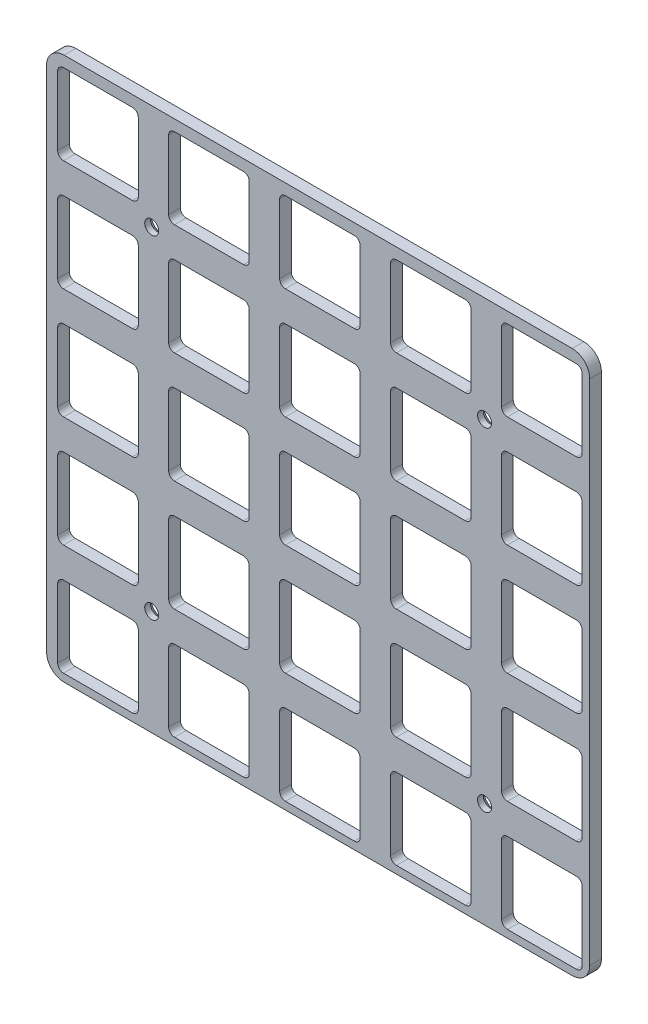
from build123d import *

# Parameters (mm, degrees)
BOSS_EXTRUDE1_DEPTH                            = 2
CSK_FOR_M2_FLAT_HEAD_MACHINE_SCREW5_AT_2_COUNT = 2
CSK_FOR_M2_FLAT_HEAD_MACHINE_SCREW5_AT_2_PITCH = 57
CSK_FOR_M2_FLAT_HEAD_MACHINE_SCREW5_AT_3_COUNT = 2
CSK_FOR_M2_FLAT_HEAD_MACHINE_SCREW5_AT_3_PITCH = 80.610173055
CSK_FOR_M2_FLAT_HEAD_MACHINE_SCREW5_AT_4_COUNT = 2
CSK_FOR_M2_FLAT_HEAD_MACHINE_SCREW5_AT_4_PITCH = 57


with BuildPart() as part:
    # Sketch2 → Boss-Extrude1 (new body)
    with BuildSketch(Plane.XY):
        with BuildLine():
            Line((-43.5, 46.5), (43.5, 46.5))
            ThreePointArc((43.5, 46.5), (45.621320344, 45.621320344), (46.5, 43.5))
            Line((46.5, 43.5), (46.5, -43.5))
            ThreePointArc((46.5, -43.5), (45.621320344, -45.621320344), (43.5, -46.5))
            Line((43.5, -46.5), (-43.5, -46.5))
            ThreePointArc((-43.5, -46.5), (-45.621320344, -45.621320344), (-46.5, -43.5))
            Line((-46.5, -43.5), (-46.5, 43.5))
            ThreePointArc((-46.5, 43.5), (-45.621320344, 45.621320344), (-43.5, 46.5))
        make_face()
        with BuildLine():
            Line((-25.6, 43.6), (-25.6, 31.8))
            ThreePointArc((-25.6, 31.8), (-25.307106781, 31.092893219), (-24.6, 30.8))
            Line((-24.6, 30.8), (-12.8, 30.8))
            ThreePointArc((-12.8, 30.8), (-12.092893219, 31.092893219), (-11.8, 31.8))
            Line((-11.8, 31.8), (-11.8, 43.6))
            ThreePointArc((-11.8, 43.6), (-12.092893219, 44.307106781), (-12.8, 44.6))
            Line((-12.8, 44.6), (-24.6, 44.6))
            ThreePointArc((-24.6, 44.6), (-25.307106781, 44.307106781), (-25.6, 43.6))
        make_face(mode=Mode.SUBTRACT)
        with BuildLine():
            Line((-43.6, 44.6), (-31.8, 44.6))
            ThreePointArc((-31.8, 44.6), (-31.092893219, 44.307106781), (-30.8, 43.6))
            Line((-30.8, 43.6), (-30.8, 31.8))
            ThreePointArc((-30.8, 31.8), (-31.092893219, 31.092893219), (-31.8, 30.8))
            Line((-31.8, 30.8), (-43.6, 30.8))
            ThreePointArc((-43.6, 30.8), (-44.307106781, 31.092893219), (-44.6, 31.8))
            Line((-44.6, 31.8), (-44.6, 43.6))
            ThreePointArc((-44.6, 43.6), (-44.307106781, 44.307106781), (-43.6, 44.6))
        make_face(mode=Mode.SUBTRACT)
        with BuildLine():
            Line((-6.6, 43.6), (-6.6, 31.8))
            ThreePointArc((-6.6, 31.8), (-6.307106781, 31.092893219), (-5.6, 30.8))
            Line((-5.6, 30.8), (6.2, 30.8))
            ThreePointArc((6.2, 30.8), (6.907106781, 31.092893219), (7.2, 31.8))
            Line((7.2, 31.8), (7.2, 43.6))
            ThreePointArc((7.2, 43.6), (6.907106781, 44.307106781), (6.2, 44.6))
            Line((6.2, 44.6), (-5.6, 44.6))
            ThreePointArc((-5.6, 44.6), (-6.307106781, 44.307106781), (-6.6, 43.6))
        make_face(mode=Mode.SUBTRACT)
        with BuildLine():
            Line((12.4, 43.6), (12.4, 31.8))
            ThreePointArc((12.4, 31.8), (12.692893219, 31.092893219), (13.4, 30.8))
            Line((13.4, 30.8), (25.2, 30.8))
            ThreePointArc((25.2, 30.8), (25.907106781, 31.092893219), (26.2, 31.8))
            Line((26.2, 31.8), (26.2, 43.6))
            ThreePointArc((26.2, 43.6), (25.907106781, 44.307106781), (25.2, 44.6))
            Line((25.2, 44.6), (13.4, 44.6))
            ThreePointArc((13.4, 44.6), (12.692893219, 44.307106781), (12.4, 43.6))
        make_face(mode=Mode.SUBTRACT)
        with BuildLine():
            Line((31.4, 43.6), (31.4, 31.8))
            ThreePointArc((31.4, 31.8), (31.692893219, 31.092893219), (32.4, 30.8))
            Line((32.4, 30.8), (44.2, 30.8))
            ThreePointArc((44.2, 30.8), (44.907106781, 31.092893219), (45.2, 31.8))
            Line((45.2, 31.8), (45.2, 43.6))
            ThreePointArc((45.2, 43.6), (44.907106781, 44.307106781), (44.2, 44.6))
            Line((44.2, 44.6), (32.4, 44.6))
            ThreePointArc((32.4, 44.6), (31.692893219, 44.307106781), (31.4, 43.6))
        make_face(mode=Mode.SUBTRACT)
        with BuildLine():
            Line((-25.6, 24.6), (-25.6, 12.8))
            ThreePointArc((-25.6, 12.8), (-25.307106781, 12.092893219), (-24.6, 11.8))
            Line((-24.6, 11.8), (-12.8, 11.8))
            ThreePointArc((-12.8, 11.8), (-12.092893219, 12.092893219), (-11.8, 12.8))
            Line((-11.8, 12.8), (-11.8, 24.6))
            ThreePointArc((-11.8, 24.6), (-12.092893219, 25.307106781), (-12.8, 25.6))
            Line((-12.8, 25.6), (-24.6, 25.6))
            ThreePointArc((-24.6, 25.6), (-25.307106781, 25.307106781), (-25.6, 24.6))
        make_face(mode=Mode.SUBTRACT)
        with BuildLine():
            Line((-6.6, 24.6), (-6.6, 12.8))
            ThreePointArc((-6.6, 12.8), (-6.307106781, 12.092893219), (-5.6, 11.8))
            Line((-5.6, 11.8), (6.2, 11.8))
            ThreePointArc((6.2, 11.8), (6.907106781, 12.092893219), (7.2, 12.8))
            Line((7.2, 12.8), (7.2, 24.6))
            ThreePointArc((7.2, 24.6), (6.907106781, 25.307106781), (6.2, 25.6))
            Line((6.2, 25.6), (-5.6, 25.6))
            ThreePointArc((-5.6, 25.6), (-6.307106781, 25.307106781), (-6.6, 24.6))
        make_face(mode=Mode.SUBTRACT)
        with BuildLine():
            Line((12.4, 24.6), (12.4, 12.8))
            ThreePointArc((12.4, 12.8), (12.692893219, 12.092893219), (13.4, 11.8))
            Line((13.4, 11.8), (25.2, 11.8))
            ThreePointArc((25.2, 11.8), (25.907106781, 12.092893219), (26.2, 12.8))
            Line((26.2, 12.8), (26.2, 24.6))
            ThreePointArc((26.2, 24.6), (25.907106781, 25.307106781), (25.2, 25.6))
            Line((25.2, 25.6), (13.4, 25.6))
            ThreePointArc((13.4, 25.6), (12.692893219, 25.307106781), (12.4, 24.6))
        make_face(mode=Mode.SUBTRACT)
        with BuildLine():
            Line((31.4, 24.6), (31.4, 12.8))
            ThreePointArc((31.4, 12.8), (31.692893219, 12.092893219), (32.4, 11.8))
            Line((32.4, 11.8), (44.2, 11.8))
            ThreePointArc((44.2, 11.8), (44.907106781, 12.092893219), (45.2, 12.8))
            Line((45.2, 12.8), (45.2, 24.6))
            ThreePointArc((45.2, 24.6), (44.907106781, 25.307106781), (44.2, 25.6))
            Line((44.2, 25.6), (32.4, 25.6))
            ThreePointArc((32.4, 25.6), (31.692893219, 25.307106781), (31.4, 24.6))
        make_face(mode=Mode.SUBTRACT)
        with BuildLine():
            Line((-25.6, 5.6), (-25.6, -6.2))
            ThreePointArc((-25.6, -6.2), (-25.307106781, -6.907106781), (-24.6, -7.2))
            Line((-24.6, -7.2), (-12.8, -7.2))
            ThreePointArc((-12.8, -7.2), (-12.092893219, -6.907106781), (-11.8, -6.2))
            Line((-11.8, -6.2), (-11.8, 5.6))
            ThreePointArc((-11.8, 5.6), (-12.092893219, 6.307106781), (-12.8, 6.6))
            Line((-12.8, 6.6), (-24.6, 6.6))
            ThreePointArc((-24.6, 6.6), (-25.307106781, 6.307106781), (-25.6, 5.6))
        make_face(mode=Mode.SUBTRACT)
        with BuildLine():
            Line((-6.6, 5.6), (-6.6, -6.2))
            ThreePointArc((-6.6, -6.2), (-6.307106781, -6.907106781), (-5.6, -7.2))
            Line((-5.6, -7.2), (6.2, -7.2))
            ThreePointArc((6.2, -7.2), (6.907106781, -6.907106781), (7.2, -6.2))
            Line((7.2, -6.2), (7.2, 5.6))
            ThreePointArc((7.2, 5.6), (6.907106781, 6.307106781), (6.2, 6.6))
            Line((6.2, 6.6), (-5.6, 6.6))
            ThreePointArc((-5.6, 6.6), (-6.307106781, 6.307106781), (-6.6, 5.6))
        make_face(mode=Mode.SUBTRACT)
        with BuildLine():
            Line((12.4, 5.6), (12.4, -6.2))
            ThreePointArc((12.4, -6.2), (12.692893219, -6.907106781), (13.4, -7.2))
            Line((13.4, -7.2), (25.2, -7.2))
            ThreePointArc((25.2, -7.2), (25.907106781, -6.907106781), (26.2, -6.2))
            Line((26.2, -6.2), (26.2, 5.6))
            ThreePointArc((26.2, 5.6), (25.907106781, 6.307106781), (25.2, 6.6))
            Line((25.2, 6.6), (13.4, 6.6))
            ThreePointArc((13.4, 6.6), (12.692893219, 6.307106781), (12.4, 5.6))
        make_face(mode=Mode.SUBTRACT)
        with BuildLine():
            Line((31.4, 5.6), (31.4, -6.2))
            ThreePointArc((31.4, -6.2), (31.692893219, -6.907106781), (32.4, -7.2))
            Line((32.4, -7.2), (44.2, -7.2))
            ThreePointArc((44.2, -7.2), (44.907106781, -6.907106781), (45.2, -6.2))
            Line((45.2, -6.2), (45.2, 5.6))
            ThreePointArc((45.2, 5.6), (44.907106781, 6.307106781), (44.2, 6.6))
            Line((44.2, 6.6), (32.4, 6.6))
            ThreePointArc((32.4, 6.6), (31.692893219, 6.307106781), (31.4, 5.6))
        make_face(mode=Mode.SUBTRACT)
        with BuildLine():
            Line((-25.6, -13.4), (-25.6, -25.2))
            ThreePointArc((-25.6, -25.2), (-25.307106781, -25.907106781), (-24.6, -26.2))
            Line((-24.6, -26.2), (-12.8, -26.2))
            ThreePointArc((-12.8, -26.2), (-12.092893219, -25.907106781), (-11.8, -25.2))
            Line((-11.8, -25.2), (-11.8, -13.4))
            ThreePointArc((-11.8, -13.4), (-12.092893219, -12.692893219), (-12.8, -12.4))
            Line((-12.8, -12.4), (-24.6, -12.4))
            ThreePointArc((-24.6, -12.4), (-25.307106781, -12.692893219), (-25.6, -13.4))
        make_face(mode=Mode.SUBTRACT)
        with BuildLine():
            Line((-6.6, -13.4), (-6.6, -25.2))
            ThreePointArc((-6.6, -25.2), (-6.307106781, -25.907106781), (-5.6, -26.2))
            Line((-5.6, -26.2), (6.2, -26.2))
            ThreePointArc((6.2, -26.2), (6.907106781, -25.907106781), (7.2, -25.2))
            Line((7.2, -25.2), (7.2, -13.4))
            ThreePointArc((7.2, -13.4), (6.907106781, -12.692893219), (6.2, -12.4))
            Line((6.2, -12.4), (-5.6, -12.4))
            ThreePointArc((-5.6, -12.4), (-6.307106781, -12.692893219), (-6.6, -13.4))
        make_face(mode=Mode.SUBTRACT)
        with BuildLine():
            Line((12.4, -13.4), (12.4, -25.2))
            ThreePointArc((12.4, -25.2), (12.692893219, -25.907106781), (13.4, -26.2))
            Line((13.4, -26.2), (25.2, -26.2))
            ThreePointArc((25.2, -26.2), (25.907106781, -25.907106781), (26.2, -25.2))
            Line((26.2, -25.2), (26.2, -13.4))
            ThreePointArc((26.2, -13.4), (25.907106781, -12.692893219), (25.2, -12.4))
            Line((25.2, -12.4), (13.4, -12.4))
            ThreePointArc((13.4, -12.4), (12.692893219, -12.692893219), (12.4, -13.4))
        make_face(mode=Mode.SUBTRACT)
        with BuildLine():
            Line((31.4, -13.4), (31.4, -25.2))
            ThreePointArc((31.4, -25.2), (31.692893219, -25.907106781), (32.4, -26.2))
            Line((32.4, -26.2), (44.2, -26.2))
            ThreePointArc((44.2, -26.2), (44.907106781, -25.907106781), (45.2, -25.2))
            Line((45.2, -25.2), (45.2, -13.4))
            ThreePointArc((45.2, -13.4), (44.907106781, -12.692893219), (44.2, -12.4))
            Line((44.2, -12.4), (32.4, -12.4))
            ThreePointArc((32.4, -12.4), (31.692893219, -12.692893219), (31.4, -13.4))
        make_face(mode=Mode.SUBTRACT)
        with BuildLine():
            Line((-25.6, -32.4), (-25.6, -44.2))
            ThreePointArc((-25.6, -44.2), (-25.307106781, -44.907106781), (-24.6, -45.2))
            Line((-24.6, -45.2), (-12.8, -45.2))
            ThreePointArc((-12.8, -45.2), (-12.092893219, -44.907106781), (-11.8, -44.2))
            Line((-11.8, -44.2), (-11.8, -32.4))
            ThreePointArc((-11.8, -32.4), (-12.092893219, -31.692893219), (-12.8, -31.4))
            Line((-12.8, -31.4), (-24.6, -31.4))
            ThreePointArc((-24.6, -31.4), (-25.307106781, -31.692893219), (-25.6, -32.4))
        make_face(mode=Mode.SUBTRACT)
        with BuildLine():
            Line((-6.6, -32.4), (-6.6, -44.2))
            ThreePointArc((-6.6, -44.2), (-6.307106781, -44.907106781), (-5.6, -45.2))
            Line((-5.6, -45.2), (6.2, -45.2))
            ThreePointArc((6.2, -45.2), (6.907106781, -44.907106781), (7.2, -44.2))
            Line((7.2, -44.2), (7.2, -32.4))
            ThreePointArc((7.2, -32.4), (6.907106781, -31.692893219), (6.2, -31.4))
            Line((6.2, -31.4), (-5.6, -31.4))
            ThreePointArc((-5.6, -31.4), (-6.307106781, -31.692893219), (-6.6, -32.4))
        make_face(mode=Mode.SUBTRACT)
        with BuildLine():
            Line((12.4, -32.4), (12.4, -44.2))
            ThreePointArc((12.4, -44.2), (12.692893219, -44.907106781), (13.4, -45.2))
            Line((13.4, -45.2), (25.2, -45.2))
            ThreePointArc((25.2, -45.2), (25.907106781, -44.907106781), (26.2, -44.2))
            Line((26.2, -44.2), (26.2, -32.4))
            ThreePointArc((26.2, -32.4), (25.907106781, -31.692893219), (25.2, -31.4))
            Line((25.2, -31.4), (13.4, -31.4))
            ThreePointArc((13.4, -31.4), (12.692893219, -31.692893219), (12.4, -32.4))
        make_face(mode=Mode.SUBTRACT)
        with BuildLine():
            Line((31.4, -32.4), (31.4, -44.2))
            ThreePointArc((31.4, -44.2), (31.692893219, -44.907106781), (32.4, -45.2))
            Line((32.4, -45.2), (44.2, -45.2))
            ThreePointArc((44.2, -45.2), (44.907106781, -44.907106781), (45.2, -44.2))
            Line((45.2, -44.2), (45.2, -32.4))
            ThreePointArc((45.2, -32.4), (44.907106781, -31.692893219), (44.2, -31.4))
            Line((44.2, -31.4), (32.4, -31.4))
            ThreePointArc((32.4, -31.4), (31.692893219, -31.692893219), (31.4, -32.4))
        make_face(mode=Mode.SUBTRACT)
        with BuildLine():
            Line((-44.6, 24.6), (-44.6, 12.8))
            ThreePointArc((-44.6, 12.8), (-44.307106781, 12.092893219), (-43.6, 11.8))
            Line((-43.6, 11.8), (-31.8, 11.8))
            ThreePointArc((-31.8, 11.8), (-31.092893219, 12.092893219), (-30.8, 12.8))
            Line((-30.8, 12.8), (-30.8, 24.6))
            ThreePointArc((-30.8, 24.6), (-31.092893219, 25.307106781), (-31.8, 25.6))
            Line((-31.8, 25.6), (-43.6, 25.6))
            ThreePointArc((-43.6, 25.6), (-44.307106781, 25.307106781), (-44.6, 24.6))
        make_face(mode=Mode.SUBTRACT)
        with BuildLine():
            Line((-44.6, 5.6), (-44.6, -6.2))
            ThreePointArc((-44.6, -6.2), (-44.307106781, -6.907106781), (-43.6, -7.2))
            Line((-43.6, -7.2), (-31.8, -7.2))
            ThreePointArc((-31.8, -7.2), (-31.092893219, -6.907106781), (-30.8, -6.2))
            Line((-30.8, -6.2), (-30.8, 5.6))
            ThreePointArc((-30.8, 5.6), (-31.092893219, 6.307106781), (-31.8, 6.6))
            Line((-31.8, 6.6), (-43.6, 6.6))
            ThreePointArc((-43.6, 6.6), (-44.307106781, 6.307106781), (-44.6, 5.6))
        make_face(mode=Mode.SUBTRACT)
        with BuildLine():
            Line((-44.6, -13.4), (-44.6, -25.2))
            ThreePointArc((-44.6, -25.2), (-44.307106781, -25.907106781), (-43.6, -26.2))
            Line((-43.6, -26.2), (-31.8, -26.2))
            ThreePointArc((-31.8, -26.2), (-31.092893219, -25.907106781), (-30.8, -25.2))
            Line((-30.8, -25.2), (-30.8, -13.4))
            ThreePointArc((-30.8, -13.4), (-31.092893219, -12.692893219), (-31.8, -12.4))
            Line((-31.8, -12.4), (-43.6, -12.4))
            ThreePointArc((-43.6, -12.4), (-44.307106781, -12.692893219), (-44.6, -13.4))
        make_face(mode=Mode.SUBTRACT)
        with BuildLine():
            Line((-44.6, -32.4), (-44.6, -44.2))
            ThreePointArc((-44.6, -44.2), (-44.307106781, -44.907106781), (-43.6, -45.2))
            Line((-43.6, -45.2), (-31.8, -45.2))
            ThreePointArc((-31.8, -45.2), (-31.092893219, -44.907106781), (-30.8, -44.2))
            Line((-30.8, -44.2), (-30.8, -32.4))
            ThreePointArc((-30.8, -32.4), (-31.092893219, -31.692893219), (-31.8, -31.4))
            Line((-31.8, -31.4), (-43.6, -31.4))
            ThreePointArc((-43.6, -31.4), (-44.307106781, -31.692893219), (-44.6, -32.4))
        make_face(mode=Mode.SUBTRACT)
    extrude(amount=BOSS_EXTRUDE1_DEPTH)

    # Sketch7 → CSK for M2 Flat Head Machine Screw5 (revolve, cut)
    with BuildSketch(Plane(origin=(-28.5, -28.5, 0), x_dir=(0, 1, 0), z_dir=(1, 0, 0))):
        Polygon((0, 0), (0, 2), (1.2, 2), (1.2, 1), (2.2, 0), align=None)
    csk_for_m2_flat_head_machine_screw5 = revolve(axis=Axis((-28.5, -28.5, -6.35), (0, 0, 1)), mode=Mode.SUBTRACT)

    # CSK for M2 Flat Head Machine Screw5 at 2: CSK for M2 Flat Head Machine Screw5 ×2
    with Locations(*[(i * CSK_FOR_M2_FLAT_HEAD_MACHINE_SCREW5_AT_2_PITCH, 0, 0) for i in range(1, CSK_FOR_M2_FLAT_HEAD_MACHINE_SCREW5_AT_2_COUNT)]):
        add(csk_for_m2_flat_head_machine_screw5, mode=Mode.SUBTRACT)

    # CSK for M2 Flat Head Machine Screw5 at 3: CSK for M2 Flat Head Machine Screw5 ×2
    with Locations(*[Vector(0.7071067811865474, 0.7071067811865477, 0) * (i * CSK_FOR_M2_FLAT_HEAD_MACHINE_SCREW5_AT_3_PITCH) for i in range(1, CSK_FOR_M2_FLAT_HEAD_MACHINE_SCREW5_AT_3_COUNT)]):
        add(csk_for_m2_flat_head_machine_screw5, mode=Mode.SUBTRACT)

    # CSK for M2 Flat Head Machine Screw5 at 4: CSK for M2 Flat Head Machine Screw5 ×2
    with Locations(*[(0, i * CSK_FOR_M2_FLAT_HEAD_MACHINE_SCREW5_AT_4_PITCH, 0) for i in range(1, CSK_FOR_M2_FLAT_HEAD_MACHINE_SCREW5_AT_4_COUNT)]):
        add(csk_for_m2_flat_head_machine_screw5, mode=Mode.SUBTRACT)


solid = part.part
